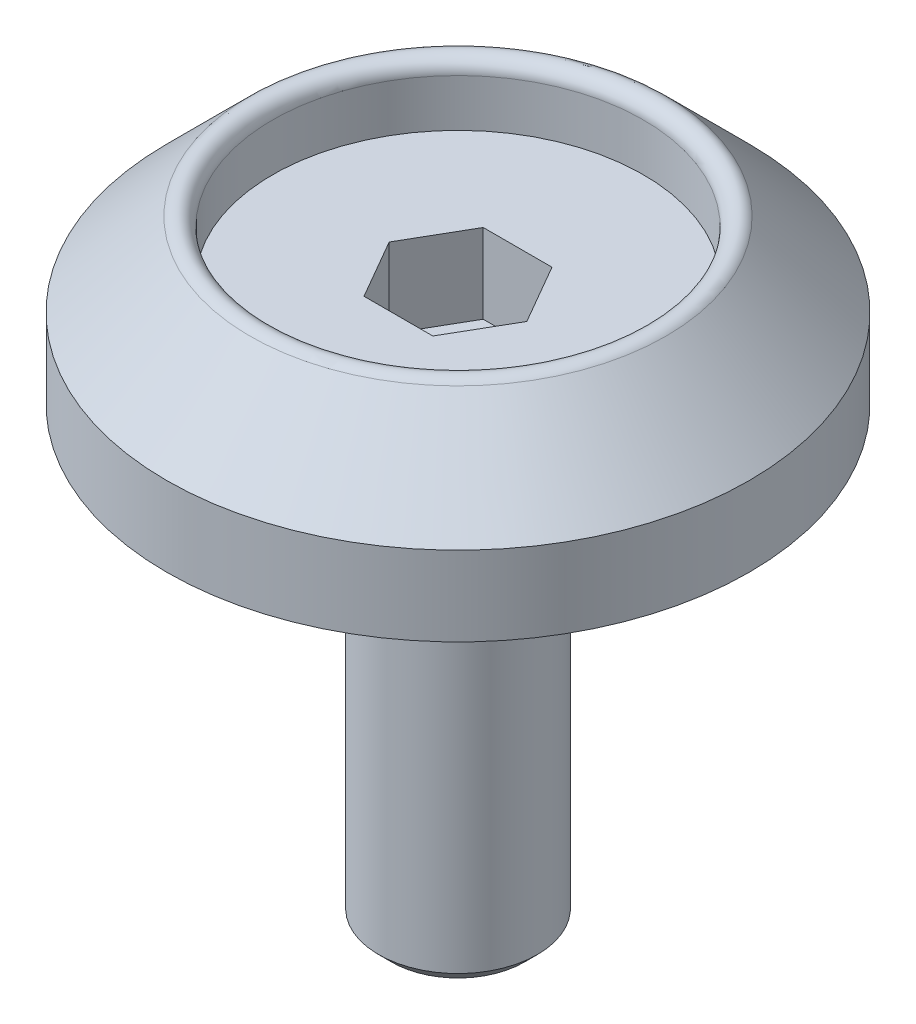
from build123d import *

# Parameters (mm, degrees)
ENL_V_MAT_EXTRU_1_DEPTH = 1.5


with BuildPart() as part:
    # Esquisse1 → Base-Révolution (revolve)
    with BuildSketch(Plane.XY):
        with BuildLine():
            Line((0, 0), (1.25, 0))
            Line((1.25, 0), (1.5, 0.25))
            Line((1.5, 0.25), (1.5, 8.5))
            Line((1.5, 8.5), (5.5, 8.5))
            Line((5.5, 8.5), (5.5, 10))
            Line((5.5, 10), (3.926776695, 11.573223305))
            ThreePointArc((3.926776695, 11.573223305), (3.654329142, 11.627416493), (3.5, 11.396446609))
            Line((3.5, 11.396446609), (3.5, 10.5))
            Line((3.5, 10.5), (0, 10.5))
            Line((0, 10.5), (0, 0))
        make_face()
    revolve(axis=Axis((0, -3.120322121, 0), (0, 1, 0)))

    # Esquisse2 → Enlèv. mat.-Extru.1 (cut)
    with BuildSketch(Plane(origin=(0, 10.5, 0), x_dir=(-1, 0, 0), z_dir=(0, 1, 0))):
        Polygon((-0.649519053, 1.125), (0.649519053, 1.125), (1.299038106, 0), (0.649519053, -1.125), (-0.649519053, -1.125), (-1.299038106, 0), align=None)
    extrude(amount=-ENL_V_MAT_EXTRU_1_DEPTH, mode=Mode.SUBTRACT)


solid = part.part
